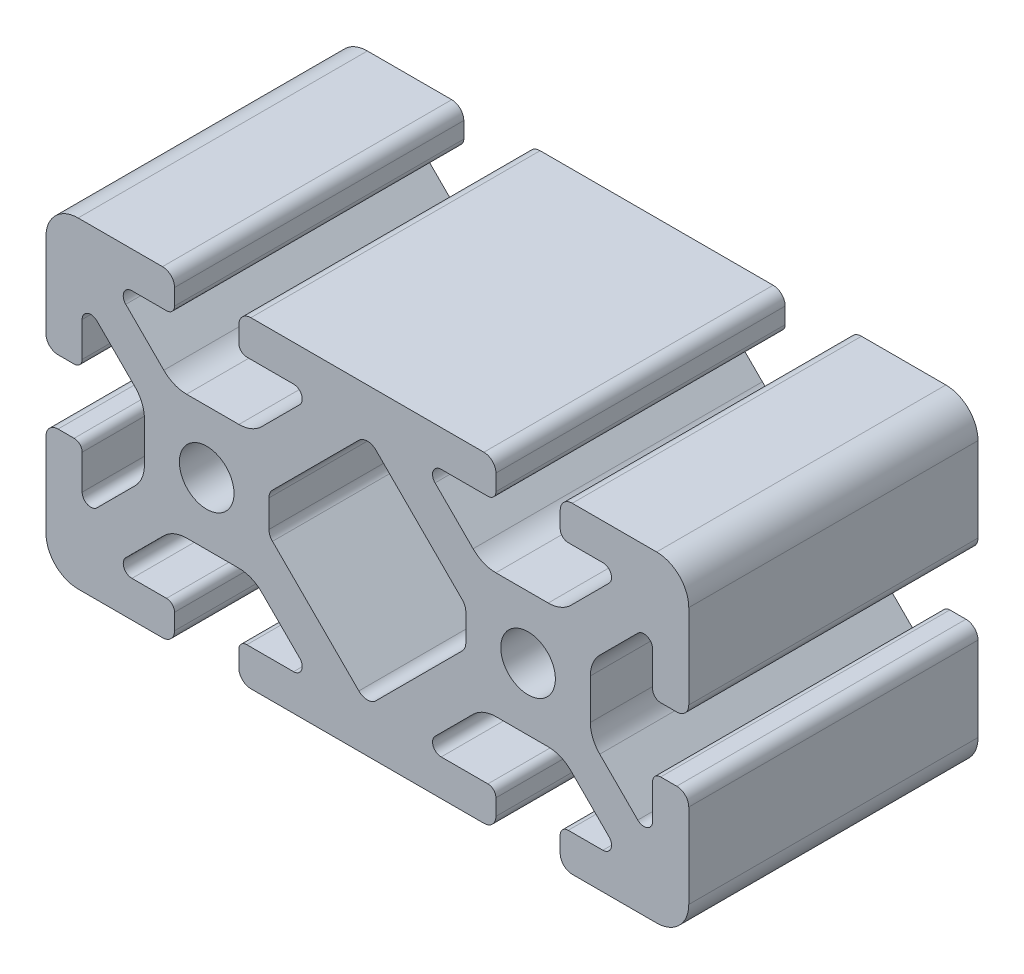
from build123d import *

# Parameters (mm, degrees)
SKETCH1_R           = 3.4
BOSS_EXTRUDE1_DEPTH = 36


with BuildPart() as part:
    # Sketch1 → Boss-Extrude1 (new body)
    with BuildSketch(Plane.XY):
        with BuildLine():
            Line((-36, -20), (-25.5, -20))
            ThreePointArc((-25.5, -20), (-24.439339828, -19.560660172), (-24, -18.5))
            Line((-24, -18.5), (-24, -16.5))
            ThreePointArc((-24, -16.5), (-24.292893219, -15.792893219), (-25, -15.5))
            Line((-25, -15.5), (-29.307617972, -15.5))
            ThreePointArc((-29.307617972, -15.5), (-30.305407867, -14.833298107), (-30.071293296, -13.656324676))
            Line((-30.071293296, -13.656324676), (-25.336541495, -8.921572875))
            ThreePointArc((-25.336541495, -8.921572875), (-24.038848099, -8.05448187), (-22.50811437, -7.75))
            Line((-22.50811437, -7.75), (-15.987648609, -7.75))
            ThreePointArc((-15.987648609, -7.75), (-14.45691488, -8.05448187), (-13.159221485, -8.921572875))
            Line((-13.159221485, -8.921572875), (-8.424469683, -13.656324676))
            ThreePointArc((-8.424469683, -13.656324676), (-8.190355112, -14.833298107), (-9.188145007, -15.5))
            Line((-9.188145007, -15.5), (-15, -15.5))
            ThreePointArc((-15, -15.5), (-15.707106781, -15.792893219), (-16, -16.5))
            Line((-16, -16.5), (-16, -18.5))
            ThreePointArc((-16, -18.5), (-15.560660172, -19.560660172), (-14.5, -20))
            Line((-14.5, -20), (14.5, -20))
            ThreePointArc((14.5, -20), (15.560660172, -19.560660172), (16, -18.5))
            Line((16, -18.5), (16, -16.5))
            ThreePointArc((16, -16.5), (15.707106781, -15.792893219), (15, -15.5))
            Line((15, -15.5), (9.188145007, -15.5))
            ThreePointArc((9.188145007, -15.5), (8.190355112, -14.833298107), (8.424469683, -13.656324676))
            Line((8.424469683, -13.656324676), (13.159221485, -8.921572875))
            ThreePointArc((13.159221485, -8.921572875), (14.45691488, -8.05448187), (15.987648609, -7.75))
            Line((15.987648609, -7.75), (22.50811437, -7.75))
            ThreePointArc((22.50811437, -7.75), (24.038848099, -8.05448187), (25.336541495, -8.921572875))
            Line((25.336541495, -8.921572875), (30.071293296, -13.656324676))
            ThreePointArc((30.071293296, -13.656324676), (30.305407867, -14.833298107), (29.307617972, -15.5))
            Line((29.307617972, -15.5), (25, -15.5))
            ThreePointArc((25, -15.5), (24.292893219, -15.792893219), (24, -16.5))
            Line((24, -16.5), (24, -18.5))
            ThreePointArc((24, -18.5), (24.439339828, -19.560660172), (25.5, -20))
            Line((25.5, -20), (36, -20))
            ThreePointArc((36, -20), (38.828427125, -18.828427125), (40, -16))
            Line((40, -16), (40, -5.5))
            ThreePointArc((40, -5.5), (39.560660172, -4.439339828), (38.5, -4))
            Line((38.5, -4), (36.5, -4))
            ThreePointArc((36.5, -4), (35.792893219, -4.292893219), (35.5, -5))
            Line((35.5, -5), (35.5, -9.307617972))
            ThreePointArc((35.5, -9.307617972), (34.833298107, -10.305407867), (33.656324676, -10.071293296))
            Line((33.656324676, -10.071293296), (28.921572875, -5.336541495))
            ThreePointArc((28.921572875, -5.336541495), (28.05448187, -4.038848099), (27.75, -2.50811437))
            Line((27.75, -2.50811437), (27.75, 2.50811437))
            ThreePointArc((27.75, 2.50811437), (28.05448187, 4.038848099), (28.921572875, 5.336541495))
            Line((28.921572875, 5.336541495), (33.656324676, 10.071293296))
            ThreePointArc((33.656324676, 10.071293296), (34.833298107, 10.305407867), (35.5, 9.307617972))
            Line((35.5, 9.307617972), (35.5, 5))
            ThreePointArc((35.5, 5), (35.792893219, 4.292893219), (36.5, 4))
            Line((36.5, 4), (38.5, 4))
            ThreePointArc((38.5, 4), (39.560660172, 4.439339828), (40, 5.5))
            Line((40, 5.5), (40, 16))
            ThreePointArc((40, 16), (38.828427125, 18.828427125), (36, 20))
            Line((36, 20), (25.5, 20))
            ThreePointArc((25.5, 20), (24.439339828, 19.560660172), (24, 18.5))
            Line((24, 18.5), (24, 16.5))
            ThreePointArc((24, 16.5), (24.292893219, 15.792893219), (25, 15.5))
            Line((25, 15.5), (29.307617972, 15.5))
            ThreePointArc((29.307617972, 15.5), (30.305407867, 14.833298107), (30.071293296, 13.656324676))
            Line((30.071293296, 13.656324676), (25.336541495, 8.921572875))
            ThreePointArc((25.336541495, 8.921572875), (24.038848099, 8.05448187), (22.50811437, 7.75))
            Line((22.50811437, 7.75), (15.987648609, 7.75))
            ThreePointArc((15.987648609, 7.75), (14.45691488, 8.05448187), (13.159221485, 8.921572875))
            Line((13.159221485, 8.921572875), (8.424469683, 13.656324676))
            ThreePointArc((8.424469683, 13.656324676), (8.190355112, 14.833298107), (9.188145007, 15.5))
            Line((9.188145007, 15.5), (15, 15.5))
            ThreePointArc((15, 15.5), (15.707106781, 15.792893219), (16, 16.5))
            Line((16, 16.5), (16, 18.5))
            ThreePointArc((16, 18.5), (15.560660172, 19.560660172), (14.5, 20))
            Line((14.5, 20), (-14.5, 20))
            ThreePointArc((-14.5, 20), (-15.560660172, 19.560660172), (-16, 18.5))
            Line((-16, 18.5), (-16, 16.5))
            ThreePointArc((-16, 16.5), (-15.707106781, 15.792893219), (-15, 15.5))
            Line((-15, 15.5), (-9.188145007, 15.5))
            ThreePointArc((-9.188145007, 15.5), (-8.190355112, 14.833298107), (-8.424469683, 13.656324676))
            Line((-8.424469683, 13.656324676), (-13.159221485, 8.921572875))
            ThreePointArc((-13.159221485, 8.921572875), (-14.45691488, 8.05448187), (-15.987648609, 7.75))
            Line((-15.987648609, 7.75), (-22.50811437, 7.75))
            ThreePointArc((-22.50811437, 7.75), (-24.038848099, 8.05448187), (-25.336541495, 8.921572875))
            Line((-25.336541495, 8.921572875), (-30.071293296, 13.656324676))
            ThreePointArc((-30.071293296, 13.656324676), (-30.305407867, 14.833298107), (-29.307617972, 15.5))
            Line((-29.307617972, 15.5), (-25, 15.5))
            ThreePointArc((-25, 15.5), (-24.292893219, 15.792893219), (-24, 16.5))
            Line((-24, 16.5), (-24, 18.5))
            ThreePointArc((-24, 18.5), (-24.439339828, 19.560660172), (-25.5, 20))
            Line((-25.5, 20), (-36, 20))
            ThreePointArc((-36, 20), (-38.828427125, 18.828427125), (-40, 16))
            Line((-40, 16), (-40, 5.5))
            ThreePointArc((-40, 5.5), (-39.560660172, 4.439339828), (-38.5, 4))
            Line((-38.5, 4), (-36.5, 4))
            ThreePointArc((-36.5, 4), (-35.792893219, 4.292893219), (-35.5, 5))
            Line((-35.5, 5), (-35.5, 9.307617972))
            ThreePointArc((-35.5, 9.307617972), (-34.833298107, 10.305407867), (-33.656324676, 10.071293296))
            Line((-33.656324676, 10.071293296), (-28.921572875, 5.336541495))
            ThreePointArc((-28.921572875, 5.336541495), (-28.05448187, 4.038848099), (-27.75, 2.50811437))
            Line((-27.75, 2.50811437), (-27.75, -2.50811437))
            ThreePointArc((-27.75, -2.50811437), (-28.05448187, -4.038848099), (-28.921572875, -5.336541495))
            Line((-28.921572875, -5.336541495), (-33.656324676, -10.071293296))
            ThreePointArc((-33.656324676, -10.071293296), (-34.833298107, -10.305407867), (-35.5, -9.307617972))
            Line((-35.5, -9.307617972), (-35.5, -5))
            ThreePointArc((-35.5, -5), (-35.792893219, -4.292893219), (-36.5, -4))
            Line((-36.5, -4), (-38.5, -4))
            ThreePointArc((-38.5, -4), (-39.560660172, -4.439339828), (-40, -5.5))
            Line((-40, -5.5), (-40, -16))
            ThreePointArc((-40, -16), (-38.828427125, -18.828427125), (-36, -20))
        make_face()
        with Locations((-20, 0)):
            Circle(SKETCH1_R, mode=Mode.SUBTRACT)
        with Locations((20, 0)):
            Circle(SKETCH1_R, mode=Mode.SUBTRACT)
        with BuildLine():
            Line((-11.810660172, 2.760660172), (-1.060660172, 13.510660172))
            ThreePointArc((-1.060660172, 13.510660172), (0, 13.95), (1.060660172, 13.510660172))
            Line((1.060660172, 13.510660172), (11.810660172, 2.760660172))
            ThreePointArc((11.810660172, 2.760660172), (12.135819299, 2.274025149), (12.25, 1.7))
            Line((12.25, 1.7), (12.25, -1.7))
            ThreePointArc((12.25, -1.7), (12.135819299, -2.274025149), (11.810660172, -2.760660172))
            Line((11.810660172, -2.760660172), (1.060660172, -13.510660172))
            ThreePointArc((1.060660172, -13.510660172), (0, -13.95), (-1.060660172, -13.510660172))
            Line((-1.060660172, -13.510660172), (-11.810660172, -2.760660172))
            ThreePointArc((-11.810660172, -2.760660172), (-12.135819299, -2.274025149), (-12.25, -1.7))
            Line((-12.25, -1.7), (-12.25, 1.7))
            ThreePointArc((-12.25, 1.7), (-12.135819299, 2.274025149), (-11.810660172, 2.760660172))
        make_face(mode=Mode.SUBTRACT)
    extrude(amount=BOSS_EXTRUDE1_DEPTH)


solid = part.part
